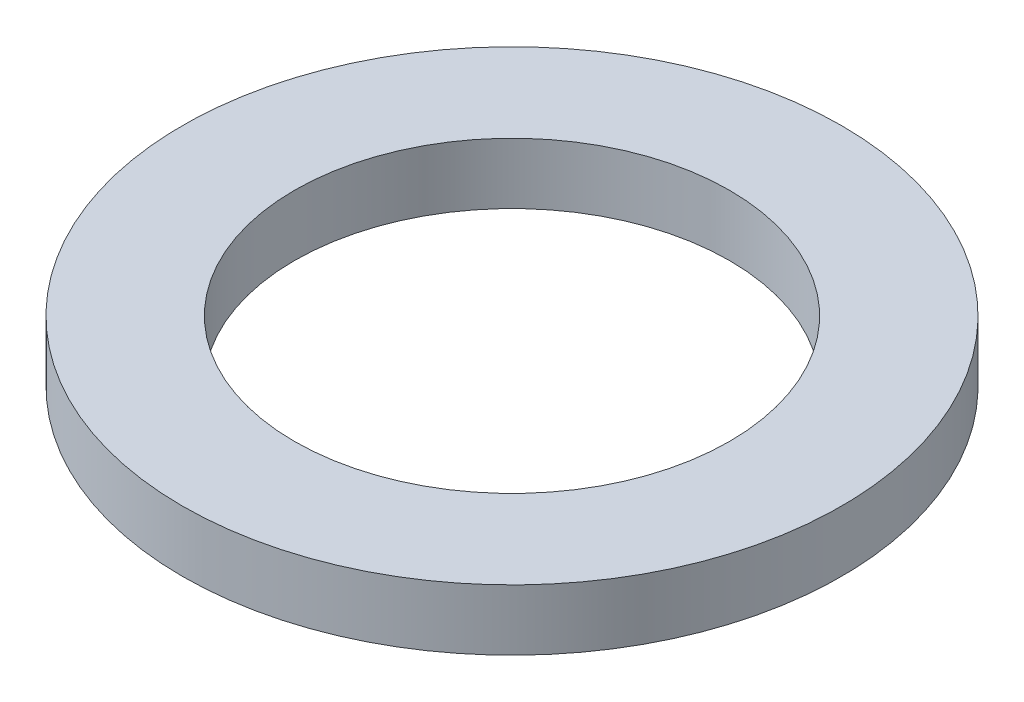
from build123d import *

# Parameters (mm, degrees)
SKETCH1_R           = 3.8481
BOSS_EXTRUDE1_DEPTH = 0.7112
SKETCH5_R           = 2.54
CUT_EXTRUDE1_DEPTH  = 6.488310547


with BuildPart() as part:
    # Sketch1 → Boss-Extrude1 (new body)
    with BuildSketch(Plane(origin=(0, 0, 0), x_dir=(1, 0, 0), z_dir=(0, 1, 0))):
        with Locations(Location((0, 0, 0), (0, 0, 270))):
            Circle(SKETCH1_R)
    extrude(amount=BOSS_EXTRUDE1_DEPTH)

    # Sketch5 → Cut-Extrude1 (cut, through all)
    with BuildSketch(Plane(origin=(0, 0.7112, 0), x_dir=(-1, 0, 0), z_dir=(0, 1, 0))):
        with Locations(Location((0, 0, 0), (0, 0, 90))):
            Circle(SKETCH5_R)
    extrude(amount=-CUT_EXTRUDE1_DEPTH, mode=Mode.SUBTRACT)


solid = part.part
